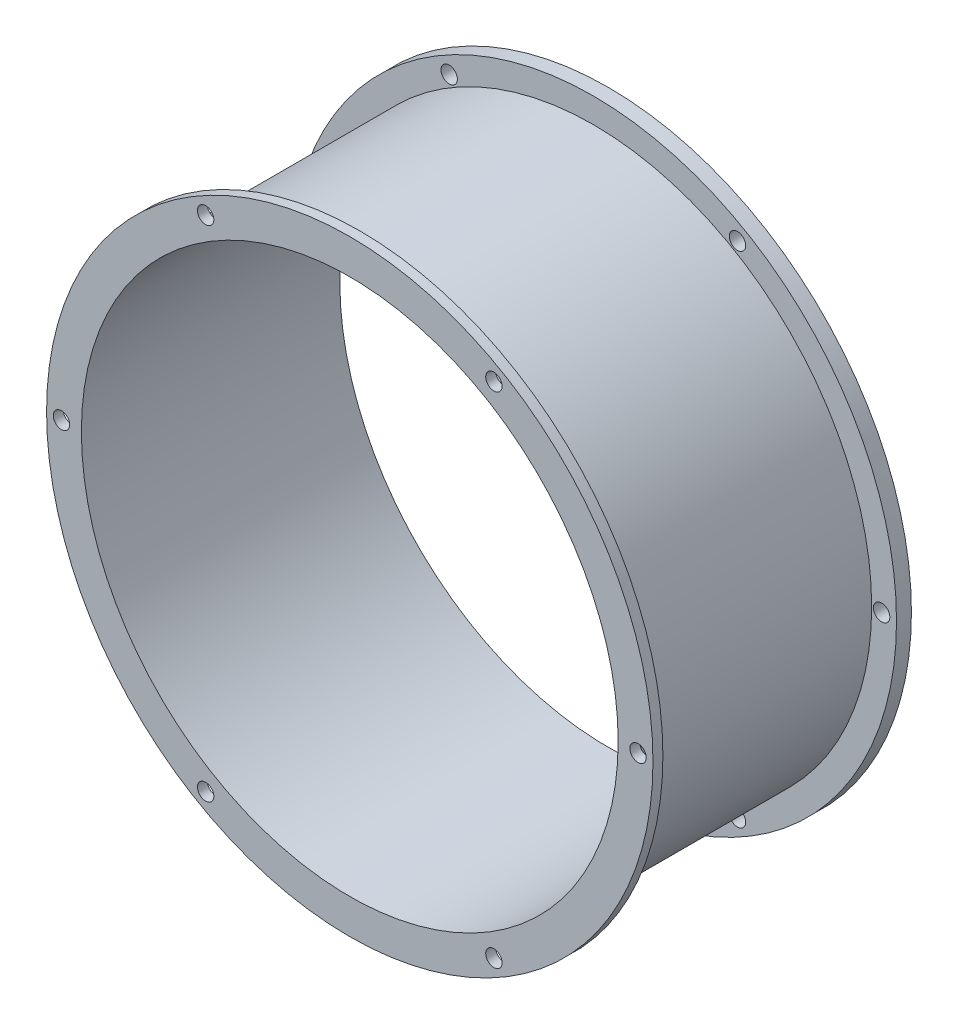
from build123d import *

# Parameters (mm, degrees)
JACKET_START        = -32
SKETCH_1_R          = 56
SKETCH_1_R_2        = 54
JACKET_DEPTH        = 52
REAR_FLANGE_START   = -32
SKETCH_2_R          = 61
SKETCH_2_R_2        = 54
REAR_FLANGE_DEPTH   = 3
FRONT_FLANGE_START  = 18
SKETCH_3_R          = 61
SKETCH_3_R_2        = 54
FRONT_FLANGE_DEPTH  = 2
SKETCH_4_R          = 1.65
THROUGH_HOLES_DEPTH = 100


with BuildPart() as part:
    # Эскиз1 → Jacket (new body)
    with BuildSketch(Plane.XY.offset(JACKET_START)):
        with Locations(Location((0, 0, 0), (0, 0, 180))):
            Circle(SKETCH_1_R)
        with Locations(Location((0, 0, 0), (0, 0, 180))):
            Circle(SKETCH_1_R_2, mode=Mode.SUBTRACT)
    extrude(amount=JACKET_DEPTH)

    # Эскиз2 → Rear_flange (add)
    with BuildSketch(Plane.XY.offset(REAR_FLANGE_START)):
        Circle(SKETCH_2_R)
        with Locations(Location((0, 0, 0), (0, 0, 180))):
            Circle(SKETCH_2_R_2, mode=Mode.SUBTRACT)
    extrude(amount=REAR_FLANGE_DEPTH)

    # Эскиз3 → Front_flange (add)
    with BuildSketch(Plane.XY.offset(FRONT_FLANGE_START)):
        Circle(SKETCH_3_R)
        with Locations(Location((0, 0, 0), (0, 0, 180))):
            Circle(SKETCH_3_R_2, mode=Mode.SUBTRACT)
    extrude(amount=FRONT_FLANGE_DEPTH)

    # Эскиз4 → Through_holes (cut, symmetric)
    with BuildSketch(Plane.XY):
        with Locations((58, 0)):
            Circle(SKETCH_4_R)
        with Locations((29, 50.229473419)):
            Circle(SKETCH_4_R)
        with Locations((-29, 50.229473419)):
            Circle(SKETCH_4_R)
        with Locations((-58, 0)):
            Circle(SKETCH_4_R)
        with Locations((-29, -50.229473419)):
            Circle(SKETCH_4_R)
        with Locations((29, -50.229473419)):
            Circle(SKETCH_4_R)
    extrude(amount=THROUGH_HOLES_DEPTH, both=True, mode=Mode.SUBTRACT)


solid = part.part
